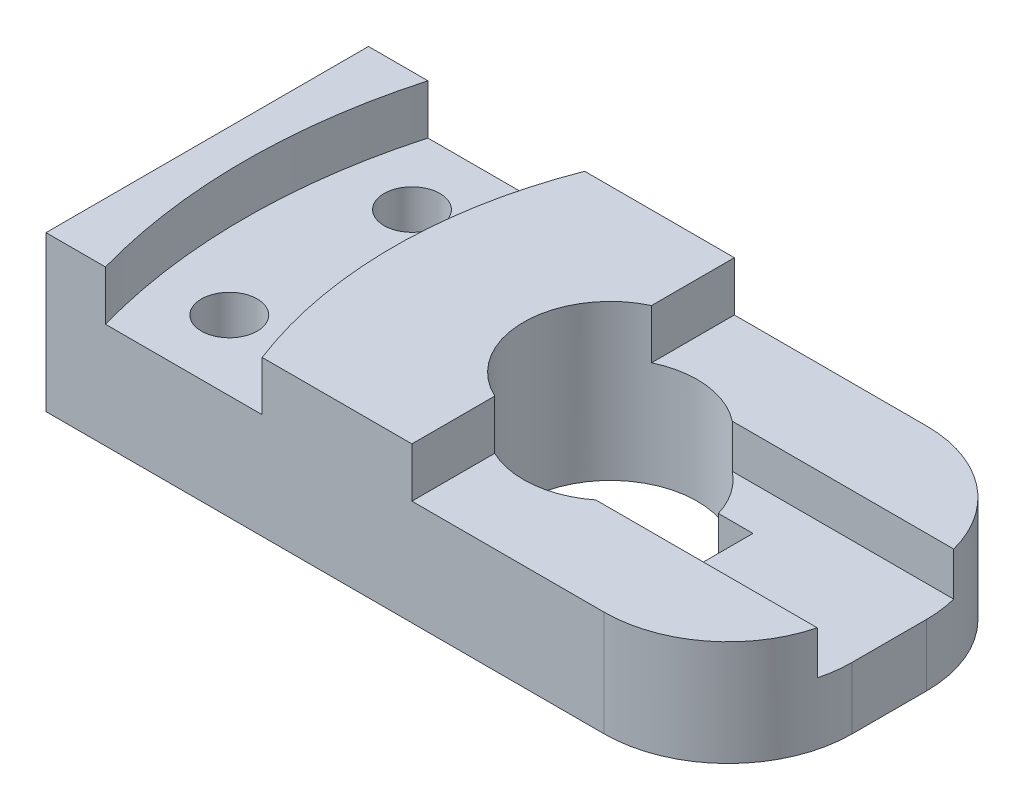
from build123d import *

# Parameters (mm, degrees)
SKETCH1_R             = 4.5
BOSS_EXTRUDE1_DEPTH   = 17
BOSS_EXTRUDE1_2_DEPTH = 17
BOSS_EXTRUDE1_3_DEPTH = 17
BOSS_EXTRUDE2_DEPTH   = 25
BOSS_EXTRUDE3_DEPTH   = 10


with BuildPart() as part:
    # Sketch1 → Boss-Extrude1 (new body)
    with BuildSketch(Plane(origin=(0, 0, 0), x_dir=(1, 0, 0), z_dir=(0, 1, 0))):
        with BuildLine():
            Line((34.858358674, 26), (9.587879583, 26))
            ThreePointArc((9.587879583, 26), (6, 0), (9.587879583, -26))
            Line((9.587879583, -26), (34.858358674, -26))
            ThreePointArc((34.858358674, -26), (30, 0), (34.858358674, 26))
        make_face()
        with Locations((18.285849122, -14.728915195)):
            Circle(SKETCH1_R, mode=Mode.SUBTRACT)
        with Locations((18.285849122, 14.728915195)):
            Circle(SKETCH1_R, mode=Mode.SUBTRACT)
    extrude(amount=BOSS_EXTRUDE1_DEPTH)



with BuildPart() as body_2:
    # Sketch1 → Boss-Extrude1 2 (new body)
    with BuildSketch(Plane(origin=(0, 0, 0), x_dir=(1, 0, 0), z_dir=(0, 1, 0))):
        with BuildLine():
            Line((90, 26), (59, 26))
            Line((59, 26), (59, 12.649110641))
            ThreePointArc((59, 12.649110641), (66.564969445, 13.91225613), (73.660254038, 11))
            Line((73.660254038, 11), (109.364916731, 11))
            ThreePointArc((109.364916731, 11), (102.247448714, 21.811388301), (90, 26))
        make_face()
    extrude(amount=BOSS_EXTRUDE1_2_DEPTH)


with BuildPart() as body_3:
    # Sketch1 → Boss-Extrude1 3 (new body)
    with BuildSketch(Plane(origin=(0, 0, 0), x_dir=(1, 0, 0), z_dir=(0, 1, 0))):
        with BuildLine():
            Line((59, -12.649110641), (59, -26))
            Line((59, -26), (90, -26))
            ThreePointArc((90, -26), (102.247448714, -21.811388301), (109.364916731, -11))
            Line((109.364916731, -11), (73.660254038, -11))
            ThreePointArc((73.660254038, -11), (66.564969445, -13.91225613), (59, -12.649110641))
        make_face()
    extrude(amount=BOSS_EXTRUDE1_3_DEPTH)


with BuildPart() as part_1:
    add(part.part)

    add(body_2.part)  # Boss-Extrude2 merges body 2

    add(body_3.part)  # Boss-Extrude2 merges body 3
    # Sketch1<3> → Boss-Extrude2 (add)
    with BuildSketch(Plane(origin=(0, 0, 0), x_dir=(1, 0, 0), z_dir=(0, 1, 0))):
        with BuildLine():
            Line((9.587879583, 26), (0, 26))
            Line((0, 26), (0, -26))
            Line((0, -26), (9.587879583, -26))
            ThreePointArc((9.587879583, -26), (6, 0), (9.587879583, 26))
        make_face()
        with BuildLine():
            Line((59, 26), (34.858358674, 26))
            ThreePointArc((34.858358674, 26), (30, 0), (34.858358674, -26))
            Line((34.858358674, -26), (59, -26))
            Line((59, -26), (59, -12.649110641))
            ThreePointArc((59, -12.649110641), (51, 0), (59, 12.649110641))
            Line((59, 12.649110641), (59, 26))
        make_face()
    extrude(amount=BOSS_EXTRUDE2_DEPTH)

    # Sketch1<4> → Boss-Extrude3 (add)
    with BuildSketch(Plane(origin=(0, 0, 0), x_dir=(1, 0, 0), z_dir=(0, 1, 0))):
        with BuildLine():
            ThreePointArc((110, 6), (109.840593925, 8.52008585), (109.364916731, 11))
            Line((109.364916731, 11), (73.660254038, 11))
            ThreePointArc((73.660254038, 11), (76.579928765, 7.86798893), (78.416407865, 4))
            Line((78.416407865, 4), (84, 4))
            Line((84, 4), (84, -4))
            Line((84, -4), (78.416407865, -4))
            ThreePointArc((78.416407865, -4), (76.579928765, -7.86798893), (73.660254038, -11))
            Line((73.660254038, -11), (109.364916731, -11))
            ThreePointArc((109.364916731, -11), (109.840593925, -8.52008585), (110, -6))
            Line((110, -6), (110, 6))
        make_face()
    extrude(amount=BOSS_EXTRUDE3_DEPTH)


solid = part_1.part
